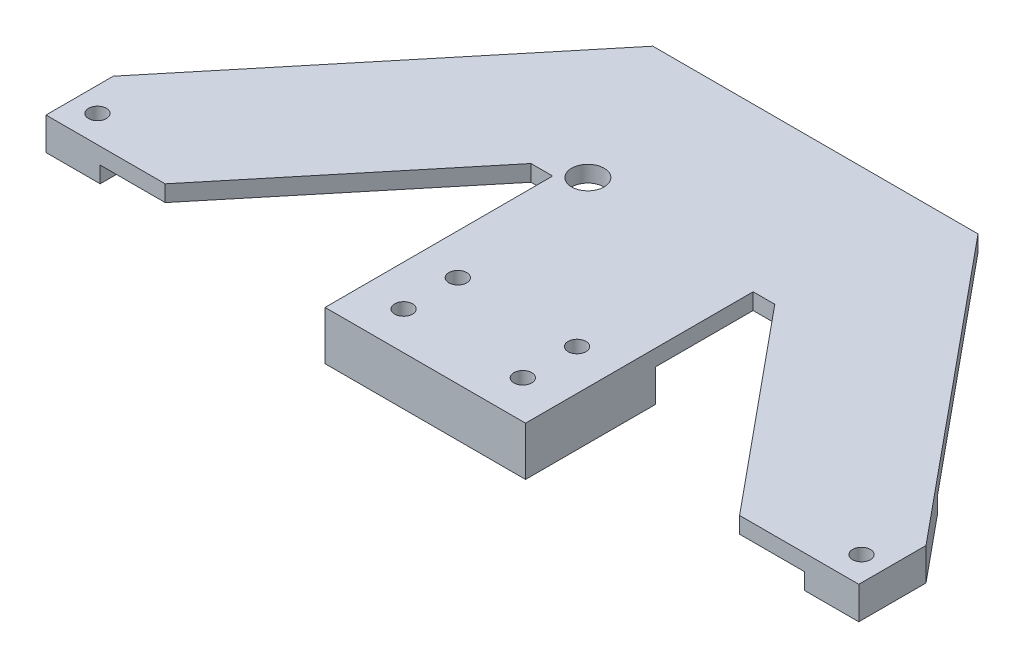
from build123d import *

# Parameters (mm, degrees)
SKETCH1_R               = 1.65
BOSS_EXTRUDE1_DEPTH     = 3
SKETCH3_W               = 37
SKETCH3_H               = 24
BOSS_EXTRUDE3_DEPTH     = 6
CUT_EXTRUDE1_DEPTH      = 10
CUT_EXTRUDE1_DEPTH_BACK = 21
SKETCH4_R               = 1.65
CUT_EXTRUDE2_DEPTH      = 10
BOSS_EXTRUDE4_START     = -3
SKETCH7_R               = 1.65
BOSS_EXTRUDE4_DEPTH     = 3


with BuildPart() as part:
    # Sketch1 → Boss-Extrude1 (new body)
    with BuildSketch(Plane(origin=(0, 0, 0), x_dir=(1, 0, 0), z_dir=(0, 1, 0))):
        Polygon((-22.5, 0), (-18.5, 0), (-18.5, -42), (18.5, -42), (18.5, 0), (22.5, 0), (53, -37), (75, -37), (75, -24.590163934), (30, 30), (-30, 30), (-75, -24.590163934), (-75, -37), (-53, -37), align=None)
        with Locations(Location((70.5, -32, 0), (0, 0, 270))):
            Circle(SKETCH1_R, mode=Mode.SUBTRACT)
        with Locations(Location((-70.5, -32, 0), (0, 0, 270))):
            Circle(SKETCH1_R, mode=Mode.SUBTRACT)
    extrude(amount=BOSS_EXTRUDE1_DEPTH)

    # Sketch3 → Boss-Extrude3 (add)
    with BuildSketch(Plane(origin=(0, 0, 0), x_dir=(1, 0, 0), z_dir=(0, 1, 0))):
        with Locations((0, -30)):
            Rectangle(SKETCH3_W, SKETCH3_H)
    extrude(amount=-BOSS_EXTRUDE3_DEPTH)

    # Sketch4 → Cut-Extrude1 (cut, two sides: drawn at the far end of the back side and taken through both)
    with BuildSketch(Plane(origin=(0, 0, 0), x_dir=(1, 0, 0), z_dir=(0, 1, 0)).offset(-CUT_EXTRUDE1_DEPTH_BACK)):
        with Locations(Location((-11, -35, 0), (0, 0, 270))):
            Circle(SKETCH4_R)
        with Locations(Location((11, -35, 0), (0, 0, 270))):
            Circle(SKETCH4_R)
        with Locations(Location((-11, -25, 0), (0, 0, 270))):
            Circle(SKETCH4_R)
        with Locations(Location((11, -25, 0), (0, 0, 270))):
            Circle(SKETCH4_R)
    extrude(amount=CUT_EXTRUDE1_DEPTH + CUT_EXTRUDE1_DEPTH_BACK, mode=Mode.SUBTRACT)

    # Sketch5 → Cut-Extrude2 (cut)
    with BuildSketch(Plane(origin=(0, 0, 0), x_dir=(1, 0, 0), z_dir=(0, 1, 0))):
        with BuildLine():
            ThreePointArc((-15, 0), (-12, 3), (-15, 6))
            ThreePointArc((-15, 6), (-18, 3), (-15, 0))
        make_face()
    extrude(amount=CUT_EXTRUDE2_DEPTH, mode=Mode.SUBTRACT)

    # Sketch7 → Boss-Extrude4 (add)
    # profile 1 of 2: a face of its own
    with BuildSketch(Plane(origin=(0, 0, 0), x_dir=(1, 0, 0), z_dir=(0, 1, 0)).offset(BOSS_EXTRUDE4_START)):
        Polygon((65, -12.459016393), (65, -37), (75, -37), (75, -24.590163934), align=None)
        with Locations(Location((70.5, -32, 0), (0, 0, 270))):
            Circle(SKETCH7_R, mode=Mode.SUBTRACT)
    # profile 2 of 2: a face of its own
    with BuildSketch(Plane(origin=(0, 0, 0), x_dir=(1, 0, 0), z_dir=(0, 1, 0)).offset(BOSS_EXTRUDE4_START)):
        Polygon((-75, -24.590163934), (-65, -12.459016393), (-65, -37), (-75, -37), align=None)
        with Locations(Location((-70.5, -32, 0), (0, 0, 270))):
            Circle(SKETCH7_R, mode=Mode.SUBTRACT)
    extrude(amount=BOSS_EXTRUDE4_DEPTH)


solid = part.part
